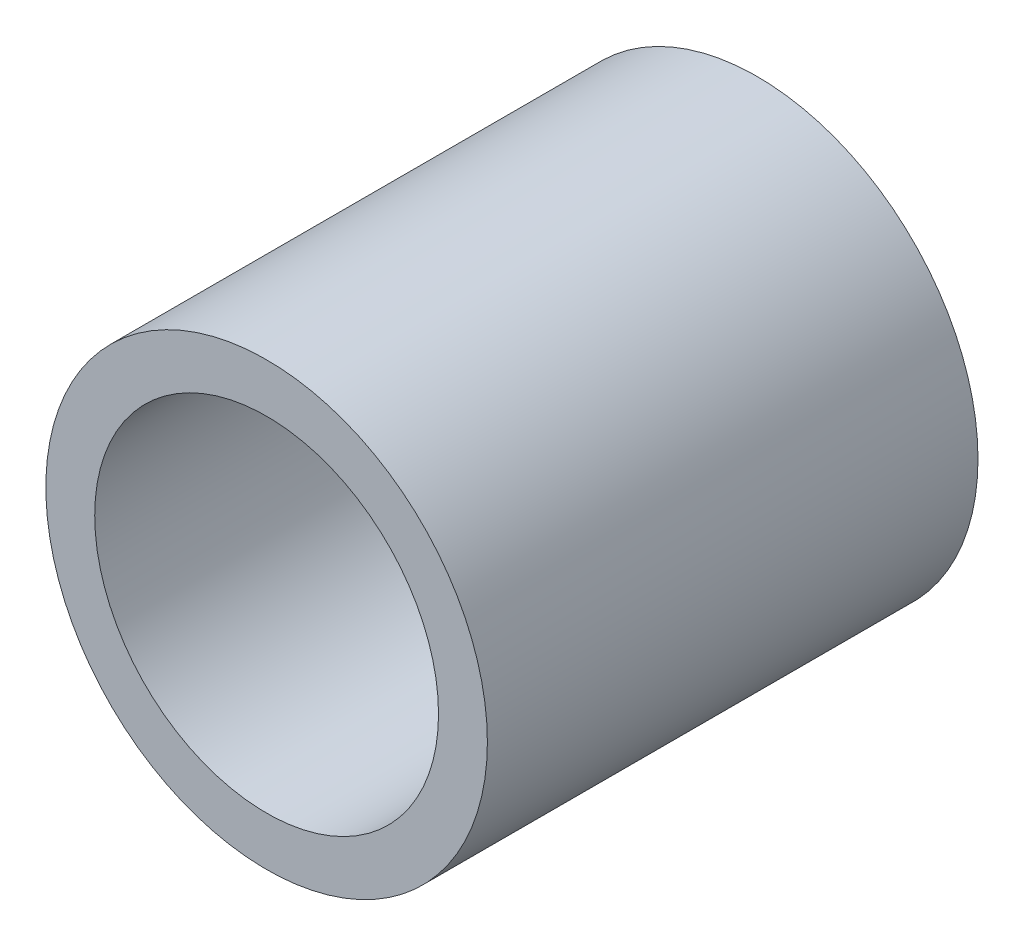
from build123d import *

# Parameters (mm, degrees)
SKETCH1_R      = 7.14375
SKETCH1_R_2    = 5.5626
EXTRUDE1_DEPTH = 7.9375


with BuildPart() as part:
    # Sketch1 → Extrude1 (new, symmetric)
    with BuildSketch(Plane.XY):
        Circle(SKETCH1_R)
        Circle(SKETCH1_R_2, mode=Mode.SUBTRACT)
    extrude(amount=EXTRUDE1_DEPTH, both=True)


solid = part.part
